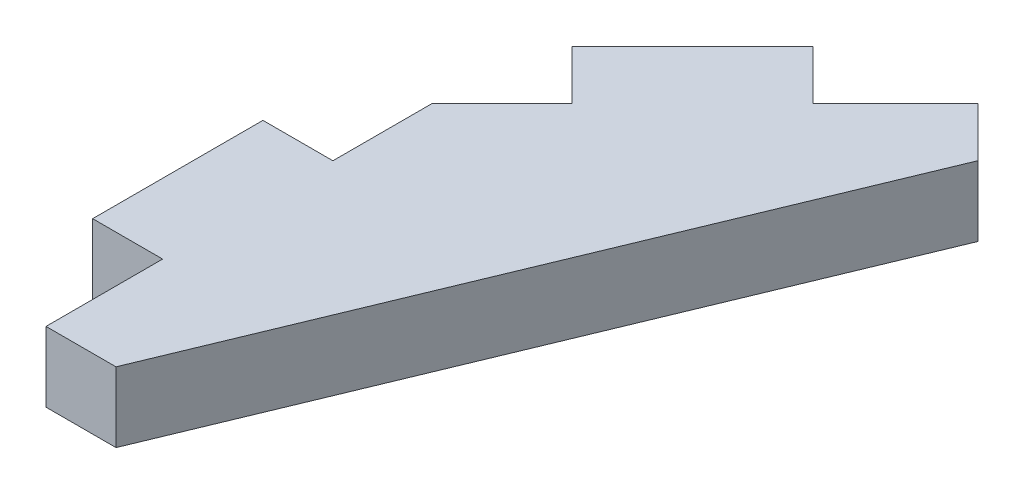
from build123d import *

# Parameters (mm, degrees)
BOSS_EXTRU_1_DEPTH = 3


with BuildPart() as part:
    # Esquisse1 → Boss.-Extru.1 (new body)
    with BuildSketch(Plane(origin=(0, 0, 0), x_dir=(1, 0, 0), z_dir=(0, 1, 0))):
        Polygon((13.824480607, 9.580753851), (3.000767967, -16.55), (0, -16.55), (0, -11.55), (-3, -11.55), (-3, -4.25), (0, -4.25), (0, 0), (3.00520382, 3.00520382), (0.883883476, 5.126524164), (6.045762979, 10.288403666), (8.167083323, 8.167083323), (11.702617229, 11.702617229), align=None)
    extrude(amount=BOSS_EXTRU_1_DEPTH)


solid = part.part
